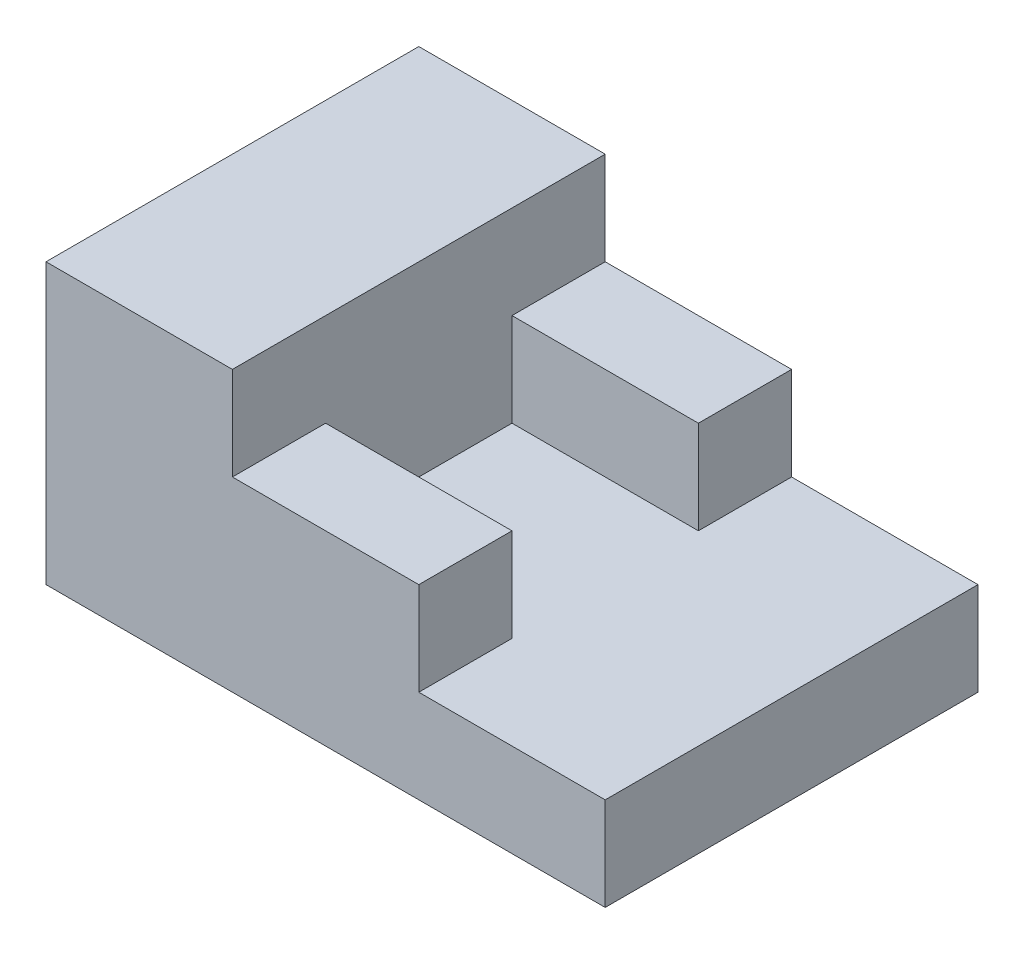
from build123d import *

# Parameters (mm, degrees)
BOSS_EXTRUDE1_DEPTH = 40
SKETCH2_W           = 20
SKETCH2_H           = 20
CUT_EXTRUDE1_DEPTH  = 10


with BuildPart() as part:
    # Sketch1 → Boss-Extrude1 (new body)
    with BuildSketch(Plane.XY):
        Polygon((-37.283950617, 15.679012346), (-37.283950617, -14.320987654), (22.716049383, -14.320987654), (22.716049383, -4.320987654), (2.716049383, -4.320987654), (2.716049383, 5.679012346), (-17.283950617, 5.679012346), (-17.283950617, 15.679012346), align=None)
    extrude(amount=BOSS_EXTRUDE1_DEPTH)

    # Sketch2 → Cut-Extrude1 (cut)
    with BuildSketch(Plane(origin=(0, 5.679012346, 0), x_dir=(1, 0, 0), z_dir=(0, 1, 0))):
        with Locations((-7.283950617, -20)):
            Rectangle(SKETCH2_W, SKETCH2_H)
    extrude(amount=-CUT_EXTRUDE1_DEPTH, mode=Mode.SUBTRACT)


solid = part.part
